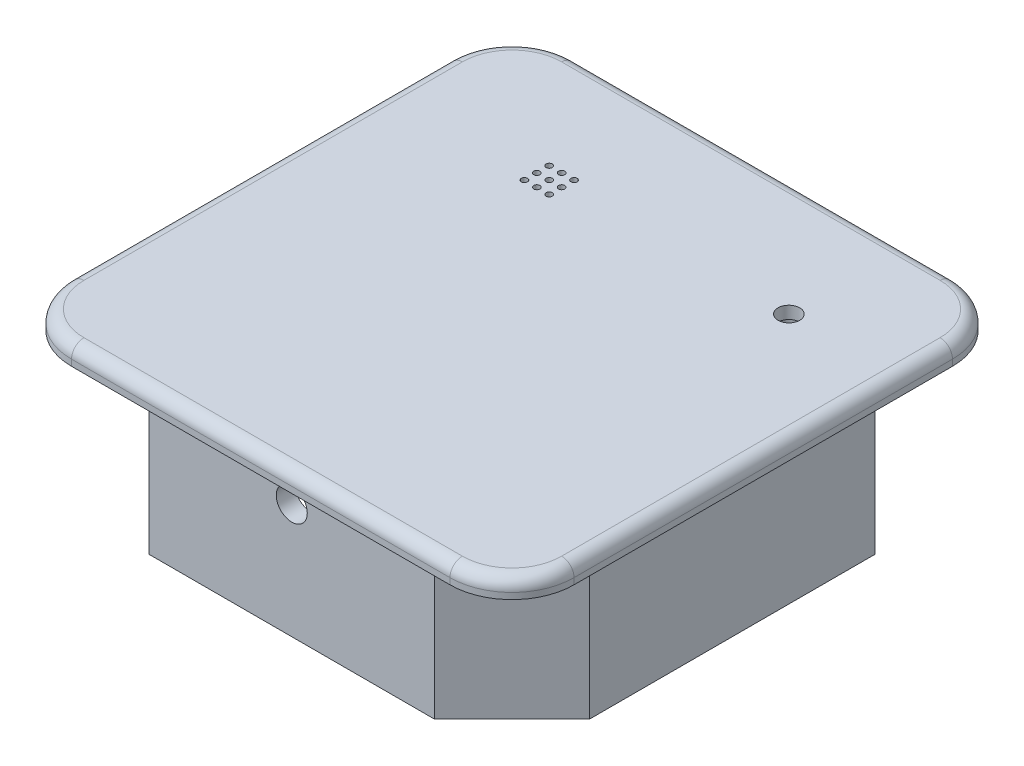
from build123d import *

# Parameters (mm, degrees)
BOSS_EXTRUDE1_DEPTH = 12.5
BOSS_EXTRUDE2_START = 12.5
BOSS_EXTRUDE2_DEPTH = 3
FILLET2_R           = 2
SHELL1_T            = -3
BOSS_EXTRUDE5_START = -20
SKETCH11_W          = 3
SKETCH11_H          = 2
BOSS_EXTRUDE5_DEPTH = 40
SKETCH12_W          = 6
SKETCH12_H          = 38
BOSS_EXTRUDE6_DEPTH = 3.5
SKETCH16_R          = 0.85
CUT_EXTRUDE5_DEPTH  = 4
CUT_EXTRUDE6_REACH  = 64.494
SKETCH17_R          = 1.75
SKETCH18_R          = 1.98
CUT_EXTRUDE7_DEPTH  = 1
CUT_EXTRUDE8_REACH  = 89.501
SKETCH19_W          = 20
SKETCH19_H          = 5
EXTRUDE_THIN1_START = 25
EXTRUDE_THIN1_DEPTH = 8
CUT_EXTRUDE9_START  = -12.5
SKETCH21_R          = 0.85
CUT_EXTRUDE9_DEPTH  = 4
CUT_EXTRUDE10_REACH = 64.494
SKETCH22_R          = 0.5
CUT_EXTRUDE12_REACH = 89.501
SKETCH23_R          = 2.5
CUT_EXTRUDE13_START = -6
SKETCH24_R          = 2.5
CUT_EXTRUDE13_DEPTH = 6
SKETCH25_R          = 8
SKETCH25_R_2        = 6
BOSS_EXTRUDE7_DEPTH = 2


with BuildPart() as part:
    # Sketch1 → Boss-Extrude1 (new, symmetric)
    with BuildSketch(Plane(origin=(0, 0, 0), x_dir=(1, 0, 0), z_dir=(0, 1, 0))):
        Polygon((-35.5, 23), (-23, 35.5), (23, 35.5), (35.5, 23), (35.5, -23), (23, -35.5), (-23, -35.5), (-35.5, -23), align=None)
    extrude(amount=BOSS_EXTRUDE1_DEPTH, both=True)

    # Sketch2 → Boss-Extrude2 (add)
    with BuildSketch(Plane(origin=(0, 0, 0), x_dir=(1, 0, 0), z_dir=(0, 1, 0)).offset(BOSS_EXTRUDE2_START)):
        with BuildLine():
            Line((-30.5, -40.5), (30.5, -40.5))
            ThreePointArc((30.5, -40.5), (37.571067812, -37.571067812), (40.5, -30.5))
            Line((40.5, -30.5), (40.5, 30.5))
            ThreePointArc((40.5, 30.5), (37.571067812, 37.571067812), (30.5, 40.5))
            Line((30.5, 40.5), (-30.5, 40.5))
            ThreePointArc((-30.5, 40.5), (-37.571067812, 37.571067812), (-40.5, 30.5))
            Line((-40.5, 30.5), (-40.5, -30.5))
            ThreePointArc((-40.5, -30.5), (-37.571067812, -37.571067812), (-30.5, -40.5))
        make_face()
    extrude(amount=BOSS_EXTRUDE2_DEPTH)

    # Fillet2
    fillet2_edges = [part.edges().sort_by_distance(p)[0] for p in [
        (0, 15.5, 40.5),
        (40.5, 15.5, 0),
        (0, 15.5, -40.5),
        (-40.5, 15.5, 0),
        (-37.571067812, 15.5, 37.571067812),
        (37.571067812, 15.5, 37.571067812),
        (37.571067812, 15.5, -37.571067812),
        (-37.571067812, 15.5, -37.571067812),
    ]]
    fillet(fillet2_edges, radius=FILLET2_R)

    # Shell1
    shell1_openings = [part.faces().sort_by_distance(p)[0] for p in [
        (0, -12.5, 0),
    ]]
    offset(amount=SHELL1_T, openings=shell1_openings, kind=Kind.INTERSECTION)

    # Sketch11 → Boss-Extrude5 (add)
    with BuildSketch(Plane(origin=(0, 0, 0), x_dir=(0, 0, -1), z_dir=(1, 0, 0)).offset(BOSS_EXTRUDE5_START)):
        with Locations((-31, 9.4)):
            Rectangle(SKETCH11_W, SKETCH11_H)
    extrude(amount=BOSS_EXTRUDE5_DEPTH)

    # Sketch12 → Boss-Extrude6 (add)
    with BuildSketch(Plane.XZ.offset(-12.5)):
        with Locations((-26, 6)):
            Rectangle(SKETCH12_W, SKETCH12_H)
        with Locations((26, 6)):
            Rectangle(SKETCH12_W, SKETCH12_H)
    extrude(amount=BOSS_EXTRUDE6_DEPTH)

    # Sketch16 → Cut-Extrude5 (cut)
    with BuildSketch(Plane.XZ.offset(-9)):
        with Locations(Location((26, 21, 0), (0, 0, 270))):
            Circle(SKETCH16_R)
        with Locations(Location((26, -9, 0), (0, 0, 270))):
            Circle(SKETCH16_R)
        with Locations(Location((-26, -9, 0), (0, 0, 90))):
            Circle(SKETCH16_R)
        with Locations(Location((-26, 21, 0), (0, 0, 90))):
            Circle(SKETCH16_R)
    extrude(amount=-CUT_EXTRUDE5_DEPTH, mode=Mode.SUBTRACT)

    # Sketch17 → Cut-Extrude6 (cut, up to next)
    with BuildSketch(Plane.XZ.offset(-12.5), mode=Mode.PRIVATE) as cut_extrude6_sk1:
        with Locations(Location((23.020139488, -21.613931872, 0), (0, 0, 270))):
            Circle(SKETCH17_R)
    cut_extrude6_tool1 = extrude(cut_extrude6_sk1.sketch, amount=-CUT_EXTRUDE6_REACH, mode=Mode.PRIVATE) & part.part
    add(cut_extrude6_tool1.solids().sort_by_distance((23.020139, 12.5, -21.613932))[0], mode=Mode.SUBTRACT)

    # Sketch18 → Cut-Extrude7 (cut)
    with BuildSketch(Plane.XZ.offset(-12.5)):
        with Locations(Location((23.020139488, -21.613931872, 0), (0, 0, 270))):
            Circle(SKETCH18_R)
    extrude(amount=-CUT_EXTRUDE7_DEPTH, mode=Mode.SUBTRACT)

    # Sketch19 → Cut-Extrude8 (cut, up to next)
    with BuildSketch(Plane.ZY.offset(35.5), mode=Mode.PRIVATE) as cut_extrude8_sk1:
        with Locations((0, 6)):
            Rectangle(SKETCH19_W, SKETCH19_H)
    cut_extrude8_tool1 = extrude(cut_extrude8_sk1.sketch, amount=-CUT_EXTRUDE8_REACH, mode=Mode.PRIVATE) & part.part
    add(cut_extrude8_tool1.solids().sort_by_distance((-35.5, 6, 0))[0], mode=Mode.SUBTRACT)

    # Sketch20 → Extrude-Thin1 (add)
    with BuildSketch(Plane.XZ.offset(-12.5).offset(EXTRUDE_THIN1_START)):
        Polygon((-32.5, 21.757359313), (-32.5, -21.757359313), (-21.757359313, -32.5), (21.757359313, -32.5), (32.5, -21.757359313), (32.5, 21.757359313), (21.757359313, 32.5), (-21.757359313, 32.5), align=None)
        Polygon((-29.5, 20.514718626), (-29.5, -20.514718626), (-20.514718626, -29.5), (20.514718626, -29.5), (29.5, -20.514718626), (29.5, 20.514718626), (20.514718626, 29.5), (-20.514718626, 29.5), align=None, mode=Mode.SUBTRACT)
    extrude(amount=-EXTRUDE_THIN1_DEPTH)

    # Sketch21 → Cut-Extrude9 (cut)
    with BuildSketch(Plane(origin=(0, 0, 0), x_dir=(1, 0, 0), z_dir=(0, 1, 0)).offset(CUT_EXTRUDE9_START)):
        with Locations(Location((0, -32.5, 0), (0, 0, 270))):
            Circle(SKETCH21_R)
        with Locations(Location((0, 32.5, 0), (0, 0, 270))):
            Circle(SKETCH21_R)
    extrude(amount=CUT_EXTRUDE9_DEPTH, mode=Mode.SUBTRACT)

    # Sketch22 → Cut-Extrude10 (cut, up to next)
    with BuildSketch(Plane.XZ.offset(-12.5), mode=Mode.PRIVATE) as cut_extrude10_sk1:
        with Locations(Location((-17, -23, 0), (0, 0, 270))):
            Circle(SKETCH22_R)
    cut_extrude10_tool1 = extrude(cut_extrude10_sk1.sketch, amount=-CUT_EXTRUDE10_REACH, mode=Mode.PRIVATE) & part.part
    # Sketch22 → Cut-Extrude10 (cut, up to next)
    with BuildSketch(Plane.XZ.offset(-12.5), mode=Mode.PRIVATE) as cut_extrude10_sk2:
        with Locations(Location((-15, -23, 0), (0, 0, 270))):
            Circle(SKETCH22_R)
    cut_extrude10_tool2 = extrude(cut_extrude10_sk2.sketch, amount=-CUT_EXTRUDE10_REACH, mode=Mode.PRIVATE) & part.part
    # Sketch22 → Cut-Extrude10 (cut, up to next)
    with BuildSketch(Plane.XZ.offset(-12.5), mode=Mode.PRIVATE) as cut_extrude10_sk3:
        with Locations(Location((-13, -23, 0), (0, 0, 270))):
            Circle(SKETCH22_R)
    cut_extrude10_tool3 = extrude(cut_extrude10_sk3.sketch, amount=-CUT_EXTRUDE10_REACH, mode=Mode.PRIVATE) & part.part
    # Sketch22 → Cut-Extrude10 (cut, up to next)
    with BuildSketch(Plane.XZ.offset(-12.5), mode=Mode.PRIVATE) as cut_extrude10_sk4:
        with Locations(Location((-15, -21, 0), (0, 0, 270))):
            Circle(SKETCH22_R)
    cut_extrude10_tool4 = extrude(cut_extrude10_sk4.sketch, amount=-CUT_EXTRUDE10_REACH, mode=Mode.PRIVATE) & part.part
    # Sketch22 → Cut-Extrude10 (cut, up to next)
    with BuildSketch(Plane.XZ.offset(-12.5), mode=Mode.PRIVATE) as cut_extrude10_sk5:
        with Locations(Location((-17, -21, 0), (0, 0, 270))):
            Circle(SKETCH22_R)
    cut_extrude10_tool5 = extrude(cut_extrude10_sk5.sketch, amount=-CUT_EXTRUDE10_REACH, mode=Mode.PRIVATE) & part.part
    # Sketch22 → Cut-Extrude10 (cut, up to next)
    with BuildSketch(Plane.XZ.offset(-12.5), mode=Mode.PRIVATE) as cut_extrude10_sk6:
        with Locations(Location((-13, -21, 0), (0, 0, 270))):
            Circle(SKETCH22_R)
    cut_extrude10_tool6 = extrude(cut_extrude10_sk6.sketch, amount=-CUT_EXTRUDE10_REACH, mode=Mode.PRIVATE) & part.part
    # Sketch22 → Cut-Extrude10 (cut, up to next)
    with BuildSketch(Plane.XZ.offset(-12.5), mode=Mode.PRIVATE) as cut_extrude10_sk7:
        with Locations(Location((-13, -19, 0), (0, 0, 90))):
            Circle(SKETCH22_R)
    cut_extrude10_tool7 = extrude(cut_extrude10_sk7.sketch, amount=-CUT_EXTRUDE10_REACH, mode=Mode.PRIVATE) & part.part
    # Sketch22 → Cut-Extrude10 (cut, up to next)
    with BuildSketch(Plane.XZ.offset(-12.5), mode=Mode.PRIVATE) as cut_extrude10_sk8:
        with Locations(Location((-15, -19, 0), (0, 0, 90))):
            Circle(SKETCH22_R)
    cut_extrude10_tool8 = extrude(cut_extrude10_sk8.sketch, amount=-CUT_EXTRUDE10_REACH, mode=Mode.PRIVATE) & part.part
    # Sketch22 → Cut-Extrude10 (cut, up to next)
    with BuildSketch(Plane.XZ.offset(-12.5), mode=Mode.PRIVATE) as cut_extrude10_sk9:
        with Locations(Location((-17, -19, 0), (0, 0, 90))):
            Circle(SKETCH22_R)
    cut_extrude10_tool9 = extrude(cut_extrude10_sk9.sketch, amount=-CUT_EXTRUDE10_REACH, mode=Mode.PRIVATE) & part.part
    add(cut_extrude10_tool1.solids().sort_by_distance((-17, 12.5, -23))[0], mode=Mode.SUBTRACT)
    add(cut_extrude10_tool2.solids().sort_by_distance((-15, 12.5, -23))[0], mode=Mode.SUBTRACT)
    add(cut_extrude10_tool3.solids().sort_by_distance((-13, 12.5, -23))[0], mode=Mode.SUBTRACT)
    add(cut_extrude10_tool4.solids().sort_by_distance((-15, 12.5, -21))[0], mode=Mode.SUBTRACT)
    add(cut_extrude10_tool5.solids().sort_by_distance((-17, 12.5, -21))[0], mode=Mode.SUBTRACT)
    add(cut_extrude10_tool6.solids().sort_by_distance((-13, 12.5, -21))[0], mode=Mode.SUBTRACT)
    add(cut_extrude10_tool7.solids().sort_by_distance((-13, 12.5, -19))[0], mode=Mode.SUBTRACT)
    add(cut_extrude10_tool8.solids().sort_by_distance((-15, 12.5, -19))[0], mode=Mode.SUBTRACT)
    add(cut_extrude10_tool9.solids().sort_by_distance((-17, 12.5, -19))[0], mode=Mode.SUBTRACT)

    # Sketch23 → Cut-Extrude12 (cut, up to next)
    with BuildSketch(Plane(origin=(0, 0, -35.5), x_dir=(-1, 0, 0), z_dir=(0, 0, -1)), mode=Mode.PRIVATE) as cut_extrude12_sk1:
        with Locations((0, 6)):
            Circle(SKETCH23_R)
    cut_extrude12_tool1 = extrude(cut_extrude12_sk1.sketch, amount=-CUT_EXTRUDE12_REACH, mode=Mode.PRIVATE) & part.part
    add(cut_extrude12_tool1.solids().sort_by_distance((0, 6, -35.5))[0], mode=Mode.SUBTRACT)

    # Sketch24 → Cut-Extrude13 (cut)
    with BuildSketch(Plane.XY.offset(35.5).offset(CUT_EXTRUDE13_START)):
        with Locations(Location((0, 6, 0), (0, 0, 180))):
            Circle(SKETCH24_R)
    extrude(amount=CUT_EXTRUDE13_DEPTH, mode=Mode.SUBTRACT)

    # Sketch25 → Boss-Extrude7 (add)
    with BuildSketch(Plane.XZ.offset(-12.5)):
        with Locations(Location((-15, -21, 0), (0, 0, 90))):
            Circle(SKETCH25_R)
        with Locations(Location((-15, -21, 0), (0, 0, 270))):
            Circle(SKETCH25_R_2, mode=Mode.SUBTRACT)
    extrude(amount=BOSS_EXTRUDE7_DEPTH)


solid = part.part
